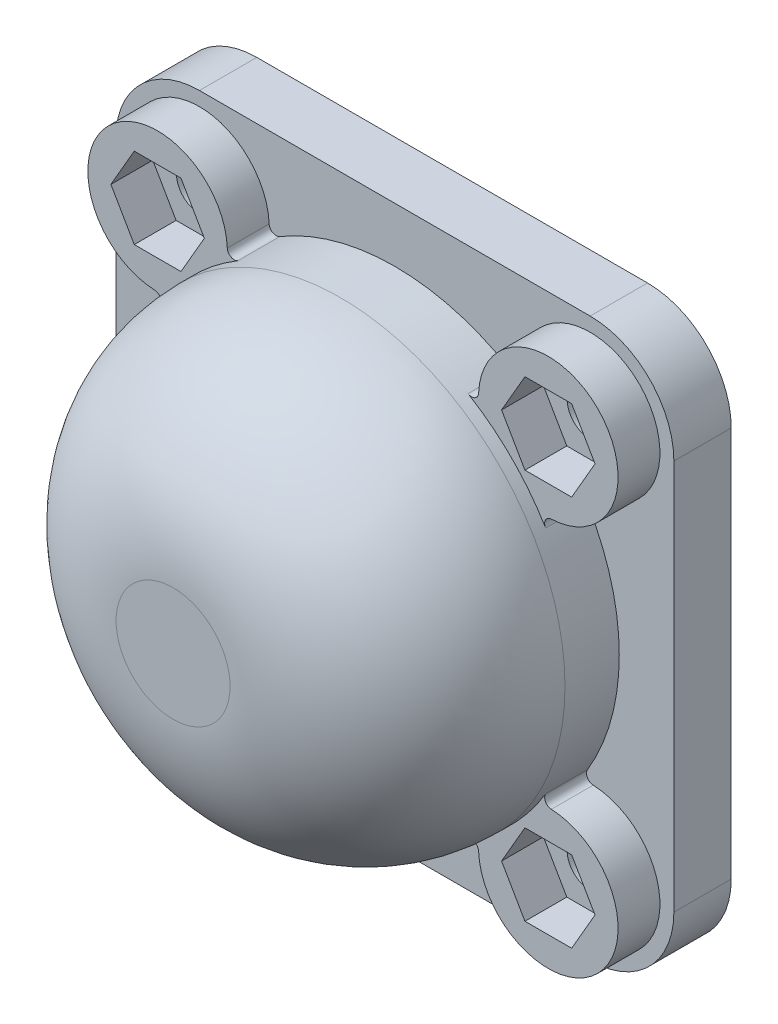
from build123d import *

# Parameters (mm, degrees)
SKETCH1_R           = 1.65
BOSS_EXTRUDE1_DEPTH = 20
BOSS_EXTRUDE2_DEPTH = 3


with BuildPart() as part:
    # Sketch1 → Boss-Extrude1 (new body)
    with BuildSketch(Plane.XY):
        with BuildLine():
            Line((-20, 14), (-20, -14))
            ThreePointArc((-20, -14), (-18.242640687, -18.242640687), (-14, -20))
            Line((-14, -20), (14, -20))
            ThreePointArc((14, -20), (18.242640687, -18.242640687), (20, -14))
            Line((20, -14), (20, 14))
            ThreePointArc((20, 14), (18.242640687, 18.242640687), (14, 20))
            Line((14, 20), (-14, 20))
            ThreePointArc((-14, 20), (-18.242640687, 18.242640687), (-20, 14))
        make_face()
        with Locations((-14, 14)):
            Circle(SKETCH1_R, mode=Mode.SUBTRACT)
        with Locations((-14, -14)):
            Circle(SKETCH1_R, mode=Mode.SUBTRACT)
        with Locations((14, -14)):
            Circle(SKETCH1_R, mode=Mode.SUBTRACT)
        with Locations((14, 14)):
            Circle(SKETCH1_R, mode=Mode.SUBTRACT)
    extrude(amount=BOSS_EXTRUDE1_DEPTH)

    # Sketch3 → Cut-Revolve3 (revolve, cut)
    with BuildSketch(Plane(origin=(0, 0, 0), x_dir=(0, 0, -1), z_dir=(1, 0, 0)), mode=Mode.PRIVATE) as cut_revolve3_sk:
        with BuildLine():
            Line((0, 0), (0, 10))
            Line((0, 10), (-0.79550681, 10))
            ThreePointArc((-0.79550681, 10), (-0.982755606, 10.036386056), (-1.14275142, 10.140248445))
            ThreePointArc((-1.14275142, 10.140248445), (-2.543582926, 11.290569335), (-4.110140926, 12.202415314))
            ThreePointArc((-4.110140926, 12.202415314), (-12.795376332, 11.702503361), (-17, 4.086443629))
            Line((-17, 4.086443629), (-17, 0))
            Line((-17, 0), (0, 0))
        make_face()
        with BuildLine():
            Line((-8, 16.086443629), (-4.110140926, 16.086443629))
            Line((-4.110140926, 16.086443629), (-4.110140926, 25.8))
            Line((-4.110140926, 25.8), (-20, 25.8))
            Line((-20, 25.8), (-20, 4.086443629))
            ThreePointArc((-20, 4.086443629), (-16.485281374, 12.571725004), (-8, 16.086443629))
        make_face()
    revolve(cut_revolve3_sk.sketch.rotate(Axis((0, 0, 22.5), (0, 0, -1)), 90), axis=Axis((0, 0, 22.5), (0, 0, -1)), mode=Mode.SUBTRACT)

    # Sketch4 → Boss-Extrude2 (add)
    # profile 1 of 4: a face of its own
    with BuildSketch(Plane.XY.offset(4.110140926)):
        with BuildLine():
            ThreePointArc((-9.004753668, 14.21797725), (-17.535533906, 17.535533906), (-14.21797725, 9.004753668))
            ThreePointArc((-14.21797725, 9.004753668), (-13.799644035, 8.742473119), (-13.810515536, 8.248838056))
            ThreePointArc((-13.810515536, 8.248838056), (-11.374833375, 11.374833375), (-8.248838056, 13.810515536))
            ThreePointArc((-8.248838056, 13.810515536), (-8.742473119, 13.799644035), (-9.004753668, 14.21797725))
        make_face()
        Polygon((-10.651368439, 14), (-12.325684219, 16.9), (-15.674315781, 16.9), (-17.348631561, 14), (-15.674315781, 11.1), (-12.325684219, 11.1), align=None, mode=Mode.SUBTRACT)
    # profile 2 of 4: a face of its own
    with BuildSketch(Plane.XY.offset(4.110140926)):
        with BuildLine():
            ThreePointArc((14.21797725, 9.004753668), (17.535533906, 17.535533906), (9.004753668, 14.21797725))
            ThreePointArc((9.004753668, 14.21797725), (8.742473119, 13.799644035), (8.248838056, 13.810515536))
            ThreePointArc((8.248838056, 13.810515536), (11.374833375, 11.374833375), (13.810515536, 8.248838056))
            ThreePointArc((13.810515536, 8.248838056), (13.799644035, 8.742473119), (14.21797725, 9.004753668))
        make_face()
        Polygon((17.348631561, 14), (15.674315781, 16.9), (12.325684219, 16.9), (10.651368439, 14), (12.325684219, 11.1), (15.674315781, 11.1), align=None, mode=Mode.SUBTRACT)
    # profile 3 of 4: a face of its own
    with BuildSketch(Plane.XY.offset(4.110140926)):
        with BuildLine():
            ThreePointArc((9.004753668, -14.21797725), (17.535533906, -17.535533906), (14.21797725, -9.004753668))
            ThreePointArc((14.21797725, -9.004753668), (13.799644035, -8.742473119), (13.810515536, -8.248838056))
            ThreePointArc((13.810515536, -8.248838056), (11.374833375, -11.374833375), (8.248838056, -13.810515536))
            ThreePointArc((8.248838056, -13.810515536), (8.742473119, -13.799644035), (9.004753668, -14.21797725))
        make_face()
        Polygon((17.348631561, -14), (15.674315781, -11.1), (12.325684219, -11.1), (10.651368439, -14), (12.325684219, -16.9), (15.674315781, -16.9), align=None, mode=Mode.SUBTRACT)
    # profile 4 of 4: a face of its own
    with BuildSketch(Plane.XY.offset(4.110140926)):
        with BuildLine():
            ThreePointArc((-14.21797725, -9.004753668), (-17.535533906, -17.535533906), (-9.004753668, -14.21797725))
            ThreePointArc((-9.004753668, -14.21797725), (-8.742473119, -13.799644035), (-8.248838056, -13.810515536))
            ThreePointArc((-8.248838056, -13.810515536), (-11.374833375, -11.374833375), (-13.810515536, -8.248838056))
            ThreePointArc((-13.810515536, -8.248838056), (-13.799644035, -8.742473119), (-14.21797725, -9.004753668))
        make_face()
        Polygon((-10.651368439, -14), (-12.325684219, -11.1), (-15.674315781, -11.1), (-17.348631561, -14), (-15.674315781, -16.9), (-12.325684219, -16.9), align=None, mode=Mode.SUBTRACT)
    extrude(amount=BOSS_EXTRUDE2_DEPTH)


solid = part.part
